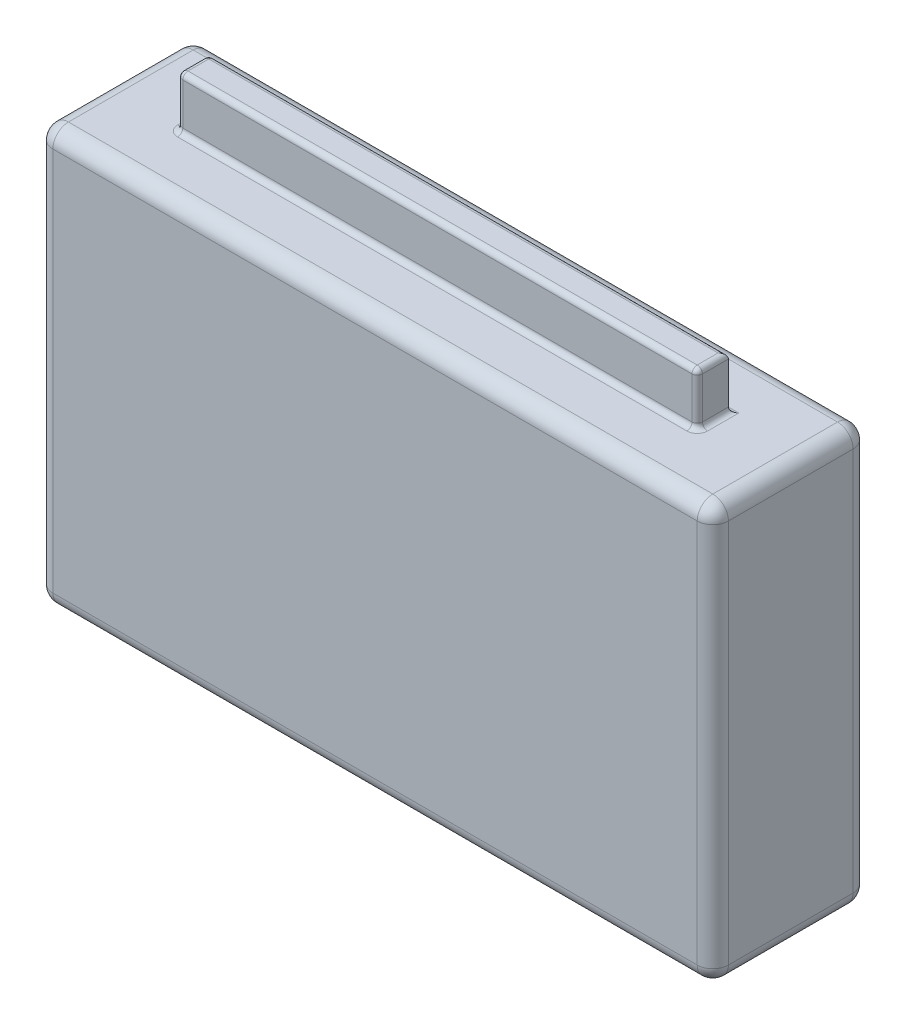
from build123d import *

# Parameters (mm, degrees)
SKETCH_1_W      = 1300
SKETCH_1_H      = 800
EXTRUDE_1_DEPTH = 300
FILLET_1_R      = 30
SKETCH_2_W      = 1000
SKETCH_2_H      = 60
EXTRUDE_2_DEPTH = 100
FILLET_2_R      = 10


with BuildPart() as part:
    # 草图1 → 凸台-拉伸1 (new body)
    with BuildSketch(Plane.XY):
        Rectangle(SKETCH_1_W, SKETCH_1_H)
    extrude(amount=EXTRUDE_1_DEPTH)

    # 圆角1
    fillet_1_edges = [part.edges().sort_by_distance(p)[0] for p in [
        (650, 0, 300),
        (0, 400, 300),
        (-650, 0, 300),
        (0, 400, 0),
        (650, 0, 0),
        (0, -400, 0),
        (-650, 0, 0),
        (0, -400, 300),
        (-650, 400, 150),
        (650, 400, 150),
        (650, -400, 150),
        (-650, -400, 150),
    ]]
    fillet(fillet_1_edges, radius=FILLET_1_R)

    # 草图2 → 凸台-拉伸2 (add)
    with BuildSketch(Plane(origin=(0, 400, 0), x_dir=(1, 0, 0), z_dir=(0, 1, 0))):
        with Locations((0, -150)):
            Rectangle(SKETCH_2_W, SKETCH_2_H)
    extrude(amount=EXTRUDE_2_DEPTH)

    # 圆角2
    fillet_2_edges = [part.edges().sort_by_distance(p)[0] for p in [
        (-500, 400, 150),
        (-500, 450, 120),
        (0, 400, 180),
        (-500, 450, 180),
        (500, 400, 150),
        (500, 450, 180),
        (0, 400, 120),
        (-500, 500, 150),
        (0, 500, 180),
        (500, 500, 150),
        (0, 500, 120),
    ]]
    fillet(fillet_2_edges, radius=FILLET_2_R)


solid = part.part
